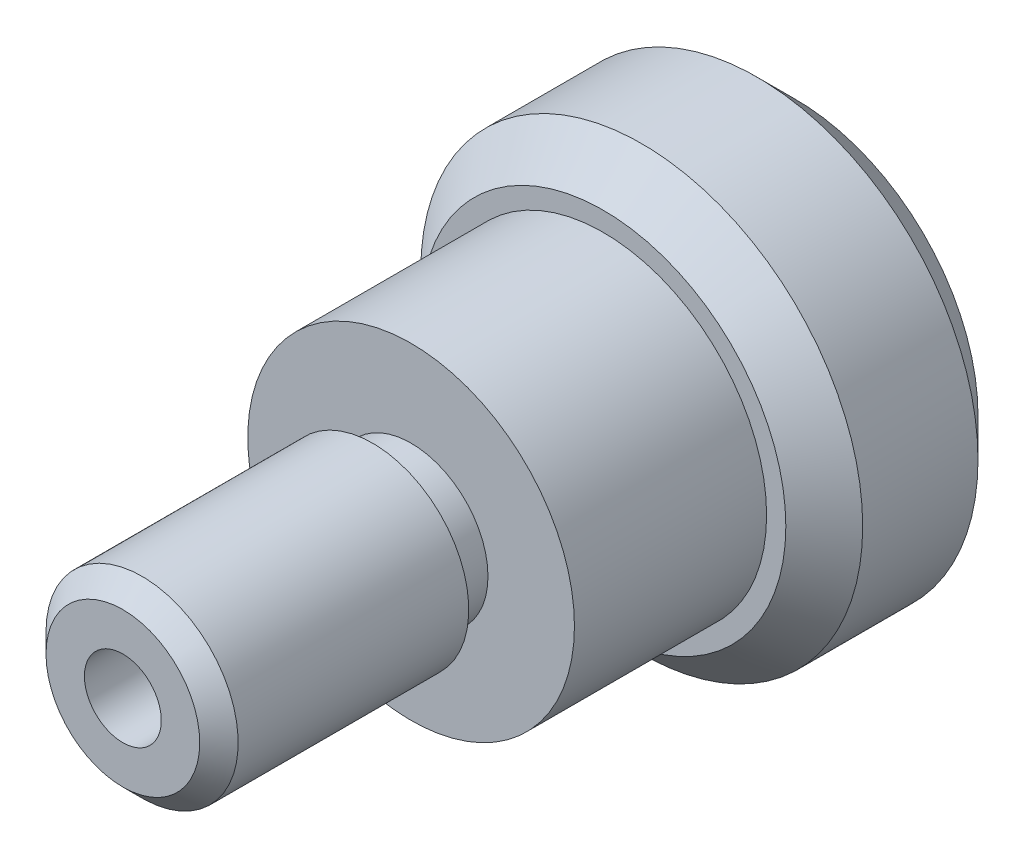
from build123d import *

# Parameters (mm, degrees)
SKETCH_1_R      = 11.5
EXTRUDE_1_DEPTH = 10
SKETCH_2_R      = 8.5
EXTRUDE_2_DEPTH = 10
SKETCH_3_R      = 4
EXTRUDE_3_DEPTH = 2
SKETCH_4_R      = 5
EXTRUDE_4_DEPTH = 13
CHAMFER_1_SIZE  = 2
CHAMFER_2_SIZE  = 1


with BuildPart() as part:
    # 草图1 → 拉伸1 (new body)
    with BuildSketch(Plane.XY):
        Circle(SKETCH_1_R)
    extrude(amount=EXTRUDE_1_DEPTH)

    # 草图2 → 拉伸2 (add)
    with BuildSketch(Plane.XY.offset(10)):
        Circle(SKETCH_2_R)
    extrude(amount=EXTRUDE_2_DEPTH)

    # 草图3 → 拉伸3 (add)
    with BuildSketch(Plane.XY.offset(20)):
        Circle(SKETCH_3_R)
    extrude(amount=EXTRUDE_3_DEPTH)

    # 草图4 → 拉伸4 (add)
    with BuildSketch(Plane.XY.offset(22)):
        with Locations(Location((0, 0, 0), (0, 0, 180))):
            Circle(SKETCH_4_R)
    extrude(amount=EXTRUDE_4_DEPTH)

    # 草图6 → 切除-旋转1 (revolve, cut)
    with BuildSketch(Plane(origin=(0, 0, 0), x_dir=(1, 0, 0), z_dir=(0, 1, 0))):
        Polygon((0, -35), (2, -35), (2, -15), (0, -13.845299462), align=None)
    revolve(axis=Axis((0, 0, 2.170078688), (0, 0, 1)), mode=Mode.SUBTRACT)

    # 草图7 → 切除-旋转2 (revolve, cut)
    with BuildSketch(Plane(origin=(0, 0, 0), x_dir=(1, 0, 0), z_dir=(0, 1, 0))):
        Polygon((-8.5, -15), (-8.5, -17), (3.5, -17), (4.654700538, -15), align=None)
    revolve(axis=Axis((-16.340863748, 0, 15), (1, 0, 0)), mode=Mode.SUBTRACT)

    # 倒角1
    chamfer_1_edges = [part.edges().sort_by_distance(p)[0] for p in [
        (-11.5, 0, 0),
        (-11.5, 0, 10),
    ]]
    chamfer(chamfer_1_edges, length=CHAMFER_1_SIZE)

    # 倒角2
    chamfer_2_edges = [part.edges().sort_by_distance(p)[0] for p in [
        (5, 0, 35),
    ]]
    chamfer(chamfer_2_edges, length=CHAMFER_2_SIZE)


solid = part.part
